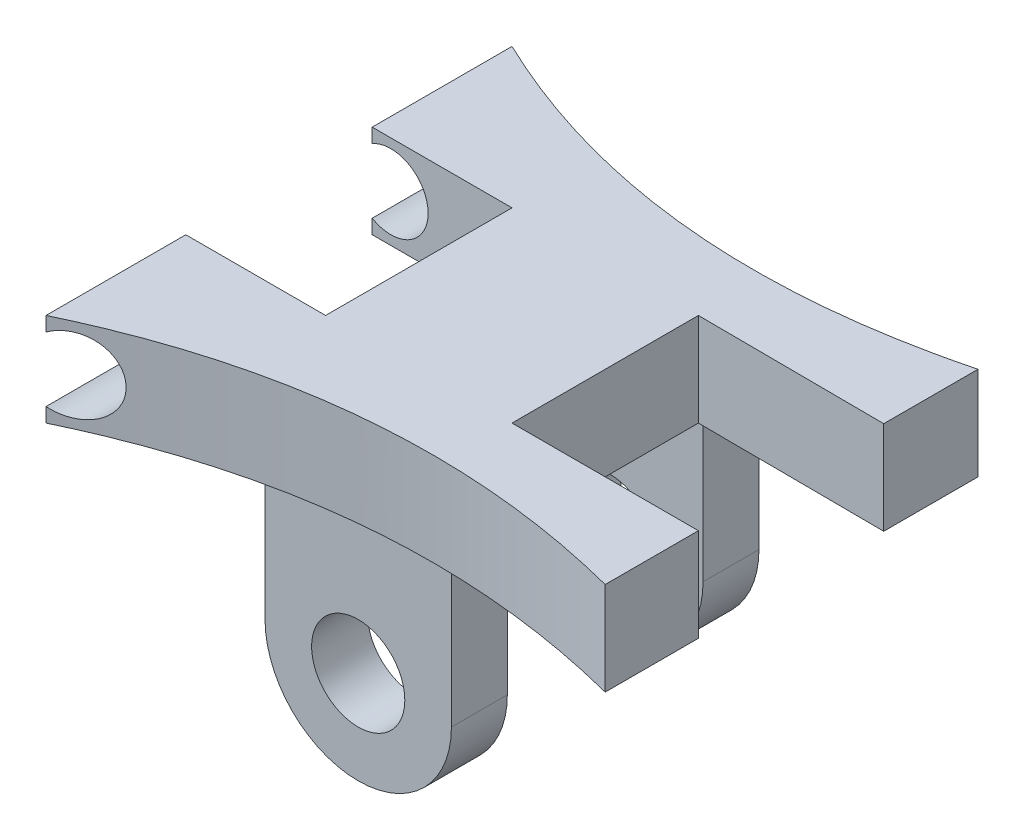
from build123d import *

# Parameters (mm, degrees)
SKETCH_1_W               = 77
SKETCH_1_H               = 10
EXTRUDE_1_DEPTH          = 55
CUT_EXTRUDE_1_DEPTH      = 639.884201719
SKETCH_4_W               = 15
SKETCH_4_H               = 20
CUT_EXTRUDE_3_DEPTH      = 10
SKETCH_5_W               = 19.997544879
SKETCH_5_H               = 6
EXTRUDE_2_DEPTH          = 26
SKETCH_8_R               = 5
CUT_EXTRUDE_4_DEPTH      = 409.554479516
CUT_EXTRUDE_5_DEPTH      = 407.529462179
CUT_EXTRUDE_5_DEPTH_BACK = 407.529462179
SKETCH_10_R              = 4


with BuildPart() as part:
    # 草图1 → 凸台-拉伸1 (new body)
    with BuildSketch(Plane.ZY.offset(242.287512766)):
        with Locations((526.914147293, -246.15455511)):
            Rectangle(SKETCH_1_W, SKETCH_1_H)
    extrude(amount=EXTRUDE_1_DEPTH)

    # 草图2 → 切除-拉伸1 (cut, through all)
    with BuildSketch(Plane(origin=(0, -241.15455511, 0), x_dir=(1, 0, 0), z_dir=(0, 1, 0))):
        with BuildLine():
            Line((-242.287512766, -506.914147293), (-242.287512766, -488.414147293))
            Line((-242.287512766, -488.414147293), (-297.287512766, -488.414147293))
            Line((-297.287512766, -488.414147293), (-297.287512766, -501.914147293))
            add(Edge.make_bspline(
                [(-242.287512766, -506.914147293), (-271.288122088, -514.395388486), (-297.287512766, -501.914147293)],
                knots=[0, 0, 0, 1, 1, 1], degree=2))
        make_face()
        with BuildLine():
            Line((-242.287512766, -546.914147293), (-242.287512766, -565.414147293))
            Line((-242.287512766, -565.414147293), (-297.287512766, -565.414147293))
            Line((-297.287512766, -565.414147293), (-297.287512766, -551.914147293))
            add(Edge.make_bspline(
                [(-242.287512766, -546.914147293), (-271.288122088, -539.4329061), (-297.287512766, -551.914147293)],
                knots=[0, 0, 0, 1, 1, 1], degree=2))
        make_face()
    extrude(amount=-CUT_EXTRUDE_1_DEPTH, mode=Mode.SUBTRACT)

    # 草图4 → 切除-拉伸3 (cut)
    with BuildSketch(Plane.XZ.offset(251.15455511)):
        Polygon((-242.287512766, 517.028807482), (-242.287512766, 526.914147293), (-242.287512766, 536.914147293), (-262.287512766, 536.914147293), (-262.287512766, 516.914147293), align=None)
        with Locations((-289.787512766, 526.914147293)):
            Rectangle(SKETCH_4_W, SKETCH_4_H)
    extrude(amount=-CUT_EXTRUDE_3_DEPTH, mode=Mode.SUBTRACT)

    # 草图5 → 凸台-拉伸2 (add)
    with BuildSketch(Plane.XZ.offset(251.15455511)):
        Polygon((-262.287512766, 537.414147293), (-282.285057645, 537.414147293), (-282.287512766, 543.414147293), (-262.287512766, 543.414147293), align=None)
        with Locations((-272.286285206, 513.414147293)):
            Rectangle(SKETCH_5_W, SKETCH_5_H)
    extrude(amount=EXTRUDE_2_DEPTH)

    # 草图8 → 切除-拉伸4 (cut, through all)
    with BuildSketch(Plane.XY.offset(543.414147293)):
        with Locations((-272.287512766, -266.15455511)):
            Circle(SKETCH_8_R)
        with BuildLine():
            Line((-262.287512766, -266.15455511), (-262.287512766, -277.15455511))
            Line((-262.287512766, -277.15455511), (-282.287512766, -277.15455511))
            Line((-282.287512766, -277.15455511), (-282.287512766, -266.15455511))
            ThreePointArc((-282.287512766, -266.15455511), (-272.287512766, -276.15455511), (-262.287512766, -266.15455511))
        make_face()
    extrude(amount=-CUT_EXTRUDE_4_DEPTH, mode=Mode.SUBTRACT)

    # 草图10 → 切除-拉伸5 (cut, two sides: drawn at the far end of the back side and taken through both)
    with BuildSketch(Plane(origin=(0, 0, 526.914147293), x_dir=(-1, 0, 0), z_dir=(0, 0, -1)).offset(-CUT_EXTRUDE_5_DEPTH_BACK)):
        with Locations((295.287512766, -246.15455511)):
            Circle(SKETCH_10_R)
    extrude(amount=CUT_EXTRUDE_5_DEPTH + CUT_EXTRUDE_5_DEPTH_BACK, mode=Mode.SUBTRACT)


solid = part.part
